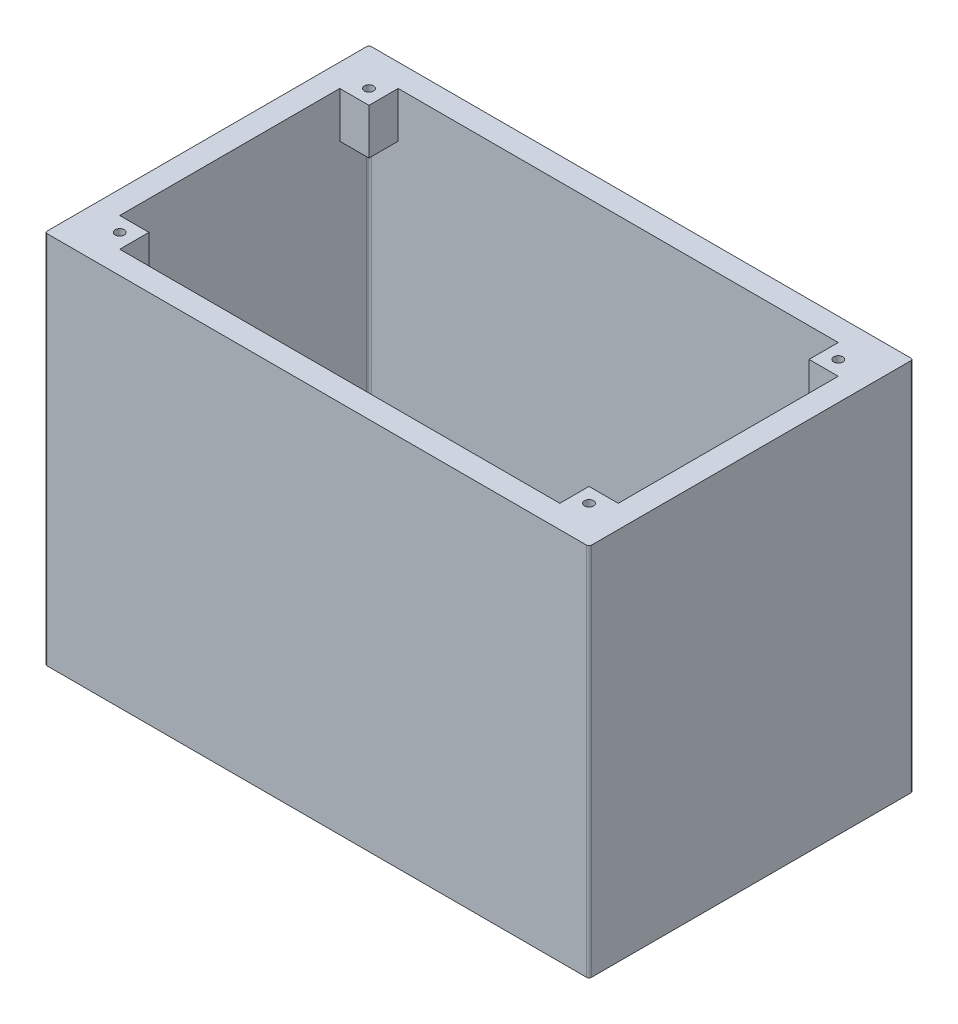
from build123d import *

# Parameters (mm, degrees)
SKETCH1_W           = 59.6
SKETCH1_H           = 35.5
BOSS_EXTRUDE1_DEPTH = 2.5
SKETCH3_W           = 59.6
SKETCH3_H           = 35.5
SKETCH3_W_2         = 54.6
SKETCH3_H_2         = 30.5
BOSS_EXTRUDE4_DEPTH = 38.5
SKETCH4_W           = 3.2
SKETCH4_H           = 3.2
SKETCH4_R           = 0.5
BOSS_EXTRUDE7_DEPTH = 5
FILLET1_R           = 0.25
FILLET2_R           = 0.25
SKETCH6_R           = 2
CUT_EXTRUDE1_DEPTH  = 5
FILLET4_R           = 0.3


with BuildPart() as part:
    # Sketch1 → Boss-Extrude1 (new body)
    with BuildSketch(Plane(origin=(0, 0, 0), x_dir=(1, 0, 0), z_dir=(0, 1, 0))):
        Rectangle(SKETCH1_W, SKETCH1_H)
    extrude(amount=BOSS_EXTRUDE1_DEPTH)

    # Sketch3 → Boss-Extrude4 (add)
    with BuildSketch(Plane(origin=(0, 2.5, 0), x_dir=(1, 0, 0), z_dir=(0, 1, 0))):
        Rectangle(SKETCH3_W, SKETCH3_H)
        Rectangle(SKETCH3_W_2, SKETCH3_H_2, mode=Mode.SUBTRACT)
    extrude(amount=BOSS_EXTRUDE4_DEPTH)

    # Sketch4 → Boss-Extrude7 (add)
    # profile 1 of 4: a face of its own
    with BuildSketch(Plane(origin=(0, 41, 0), x_dir=(1, 0, 0), z_dir=(0, 1, 0))):
        with Locations((-25.7, 13.65)):
            Rectangle(SKETCH4_W, SKETCH4_H)
        with Locations(Location((-25.7, 13.65, 0), (0, 0, 270))):
            Circle(SKETCH4_R, mode=Mode.SUBTRACT)
    # profile 2 of 4: a face of its own
    with BuildSketch(Plane(origin=(0, 41, 0), x_dir=(1, 0, 0), z_dir=(0, 1, 0))):
        with Locations((25.7, 13.65)):
            Rectangle(SKETCH4_W, SKETCH4_H)
        with Locations(Location((25.7, 13.65, 0), (0, 0, 270))):
            Circle(SKETCH4_R, mode=Mode.SUBTRACT)
    # profile 3 of 4: a face of its own
    with BuildSketch(Plane(origin=(0, 41, 0), x_dir=(1, 0, 0), z_dir=(0, 1, 0))):
        with Locations((25.7, -13.65)):
            Rectangle(SKETCH4_W, SKETCH4_H)
        with Locations(Location((25.7, -13.65, 0), (0, 0, 270))):
            Circle(SKETCH4_R, mode=Mode.SUBTRACT)
    # profile 4 of 4: a face of its own
    with BuildSketch(Plane(origin=(0, 41, 0), x_dir=(1, 0, 0), z_dir=(0, 1, 0))):
        with Locations((-25.7, -13.65)):
            Rectangle(SKETCH4_W, SKETCH4_H)
        with Locations(Location((-25.7, -13.65, 0), (0, 0, 270))):
            Circle(SKETCH4_R, mode=Mode.SUBTRACT)
    extrude(amount=-BOSS_EXTRUDE7_DEPTH)

    # Fillet1
    fillet1_edges = [part.edges().sort_by_distance(p)[0] for p in [
        (-29.8, 20.5, -17.75),
        (-29.8, 20.5, 17.75),
        (29.8, 20.5, 17.75),
        (29.8, 20.5, -17.75),
    ]]
    fillet(fillet1_edges, radius=FILLET1_R)

    # Fillet2
    fillet2_edges = [part.edges().sort_by_distance(p)[0] for p in [
        (0, 2.5, -15.25),
        (-27.3, 19.25, -15.25),
        (27.3, 19.25, -15.25),
        (27.3, 19.25, 15.25),
        (-27.3, 19.25, 15.25),
    ]]
    fillet(fillet2_edges, radius=FILLET2_R)

    # Sketch6 → Cut-Extrude1 (cut)
    with BuildSketch(Plane.ZY.offset(29.8)):
        with Locations((5.5, 12)):
            Circle(SKETCH6_R)
    extrude(amount=-CUT_EXTRUDE1_DEPTH, mode=Mode.SUBTRACT)

    # Fillet4
    fillet4_edges = [part.edges().sort_by_distance(p)[0] for p in [
        (-29.8, 12, 3.5),
    ]]
    fillet(fillet4_edges, radius=FILLET4_R)


solid = part.part
